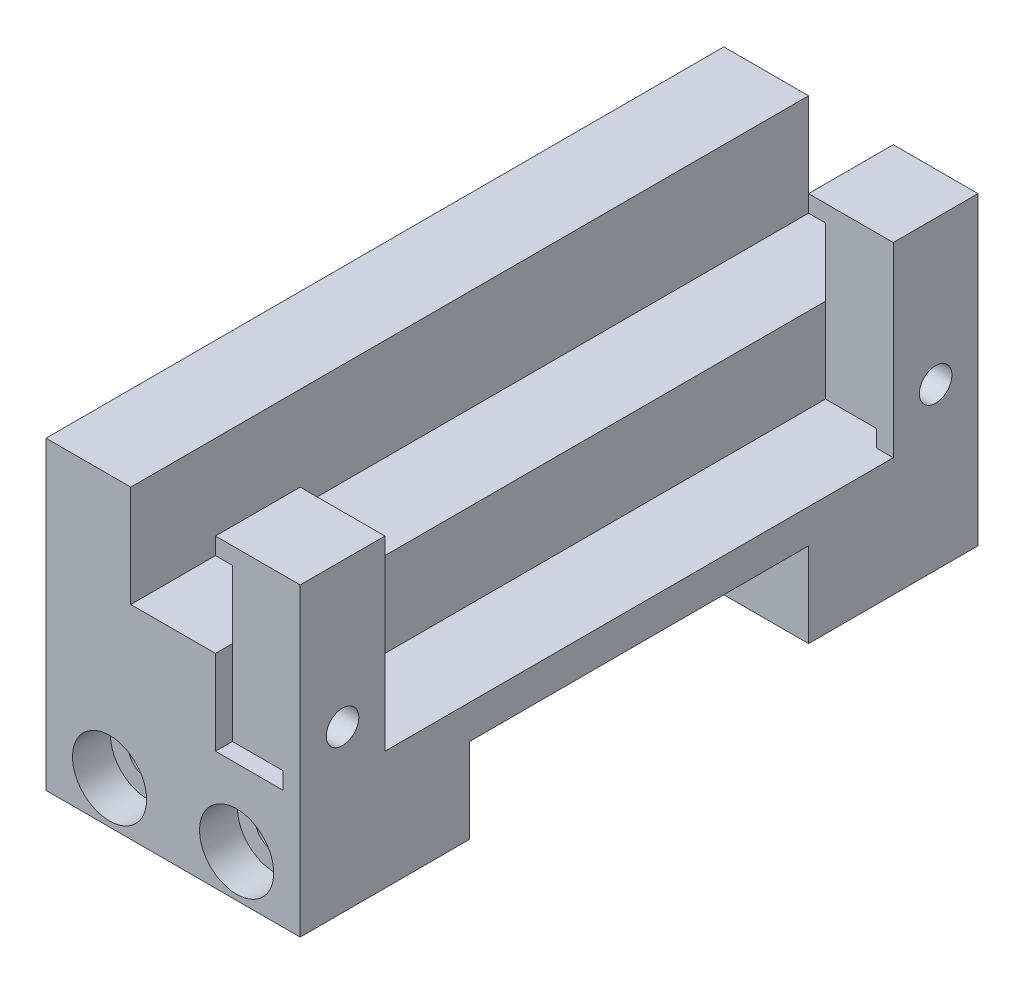
from build123d import *

# Parameters (mm, degrees)
SKETCH2_W                                      = 19.05
SKETCH2_H                                      = 19.05
BOSS_EXTRUDE1_DEPTH                            = 25.4
CUT_EXTRUDE1_DEPTH                             = 54.497649479
SKETCH6_W                                      = 1.27
SKETCH6_H                                      = 11.43
SKETCH6_H_2                                    = 1.27
SKETCH6_W_2                                    = 3.81
CUT_EXTRUDE2_DEPTH                             = 54.497649479
CUT_EXTRUDE3_REACH                             = 35.148
SKETCH7_W                                      = 38.1
SKETCH7_H                                      = 13.97
SKETCH8_W                                      = 19.05
SKETCH8_H                                      = 6.35
BOSS_EXTRUDE2_DEPTH                            = 12.7
CBORE_FOR_4_SOCKET_HEAD_CAP_SCREW1_D           = 2.9464
CBORE_FOR_4_SOCKET_HEAD_CAP_SCREW1_DEPTH       = 12.7
CBORE_FOR_4_SOCKET_HEAD_CAP_SCREW1_CBORE_D     = 5.55752
CBORE_FOR_4_SOCKET_HEAD_CAP_SCREW1_CBORE_DEPTH = 2.8448
F_2_CLEARANCE_HOLE1_D                          = 2.4384
F_2_CLEARANCE_HOLE1_DEPTH                      = 5.08
F_2_56_TAPPED_HOLE1_D                          = 1.778


with BuildPart() as part:
    # Sketch2 → Boss-Extrude1 (new, symmetric)
    with BuildSketch(Plane.XY):
        Rectangle(SKETCH2_W, SKETCH2_H)
    extrude(amount=BOSS_EXTRUDE1_DEPTH, both=True)

    # Sketch4 → Cut-Extrude1 (cut, through all)
    with BuildSketch(Plane(origin=(-1.506852909, 3.110534069, 25.4), x_dir=(1, 0, 0), z_dir=(0, 0, 1))):
        Polygon((-8.018147091, 6.414465931), (-8.018147091, 3.874465931), (-1.668147091, 3.874465931), (-1.668147091, -3.745534069), (4.681852909, -3.745534069), (4.681852909, 3.874465931), (11.031852909, 3.874465931), (11.031852909, 6.414465931), align=None)
    extrude(amount=-CUT_EXTRUDE1_DEPTH, mode=Mode.SUBTRACT)

    # Sketch6 → Cut-Extrude2 (cut, through all)
    with BuildSketch(Plane(origin=(-1.506852909, 3.110534069, 25.4), x_dir=(1, 0, 0), z_dir=(0, 0, 1))):
        with Locations((5.316852909, -3.110534069)):
            Rectangle(SKETCH6_W, SKETCH6_H)
        with Locations((5.316852909, -9.460534069)):
            Rectangle(SKETCH6_W, SKETCH6_H_2)
        with Locations((7.856852909, -9.460534069)):
            Rectangle(SKETCH6_W_2, SKETCH6_H_2)
    extrude(amount=-CUT_EXTRUDE2_DEPTH, mode=Mode.SUBTRACT)

    # Cut-Extrude3: up to this face of the body (flat: up to its plane)
    cut_extrude3_end = Plane(part.part.faces().sort_by_distance((3.175, 6.35, 0))[0])
    # Sketch7 → Cut-Extrude3 (cut, up to the picked face)
    with BuildSketch(Plane(origin=(9.525, 0, 0), x_dir=(0, 0, -1), z_dir=(1, 0, 0)), mode=Mode.PRIVATE) as cut_extrude3_sk1:
        Rectangle(SKETCH7_W, SKETCH7_H)
    cut_extrude3_tool1 = split(extrude(cut_extrude3_sk1.sketch, amount=-CUT_EXTRUDE3_REACH, mode=Mode.PRIVATE), bisect_by=cut_extrude3_end, keep=Keep.BOTH, mode=Mode.PRIVATE)
    add(cut_extrude3_tool1.solids().sort_by(Axis((9.525, 0, 0), (-1, 0, 0)))[0], mode=Mode.SUBTRACT)

    # Sketch8 → Boss-Extrude2 (add)
    with BuildSketch(Plane.XY.offset(25.4)):
        with Locations((0, -12.7)):
            Rectangle(SKETCH8_W, SKETCH8_H)
    boss_extrude2 = extrude(amount=-BOSS_EXTRUDE2_DEPTH)

    # Mirror1: Boss-Extrude2 across plane
    add(boss_extrude2.mirror(Plane.XY))

    # CBORE for #4 Socket Head Cap Screw1
    with Locations(Plane.XY.offset(25.4)):
        with Locations((-4.7625, -12.7), (4.7625, -12.7)):
            CounterBoreHole(CBORE_FOR_4_SOCKET_HEAD_CAP_SCREW1_D / 2, CBORE_FOR_4_SOCKET_HEAD_CAP_SCREW1_CBORE_D / 2, CBORE_FOR_4_SOCKET_HEAD_CAP_SCREW1_CBORE_DEPTH, depth=CBORE_FOR_4_SOCKET_HEAD_CAP_SCREW1_DEPTH)

    # #2 Clearance Hole1
    with Locations(Plane(origin=(9.525, 0, 0), x_dir=(0, 0, -1), z_dir=(1, 0, 0))):
        with Locations((-22.225, -3.81), (22.225, -3.81)):
            Hole(F_2_CLEARANCE_HOLE1_D / 2, depth=F_2_CLEARANCE_HOLE1_DEPTH)

    # #2-56 Tapped Hole1 (through all)
    with Locations(Plane(origin=(3.175, 0, 0), x_dir=(0, 0, -1), z_dir=(1, 0, 0))):
        with Locations((-22.225, -3.81), (22.225, -3.81)):
            Hole(F_2_56_TAPPED_HOLE1_D / 2)


solid = part.part
